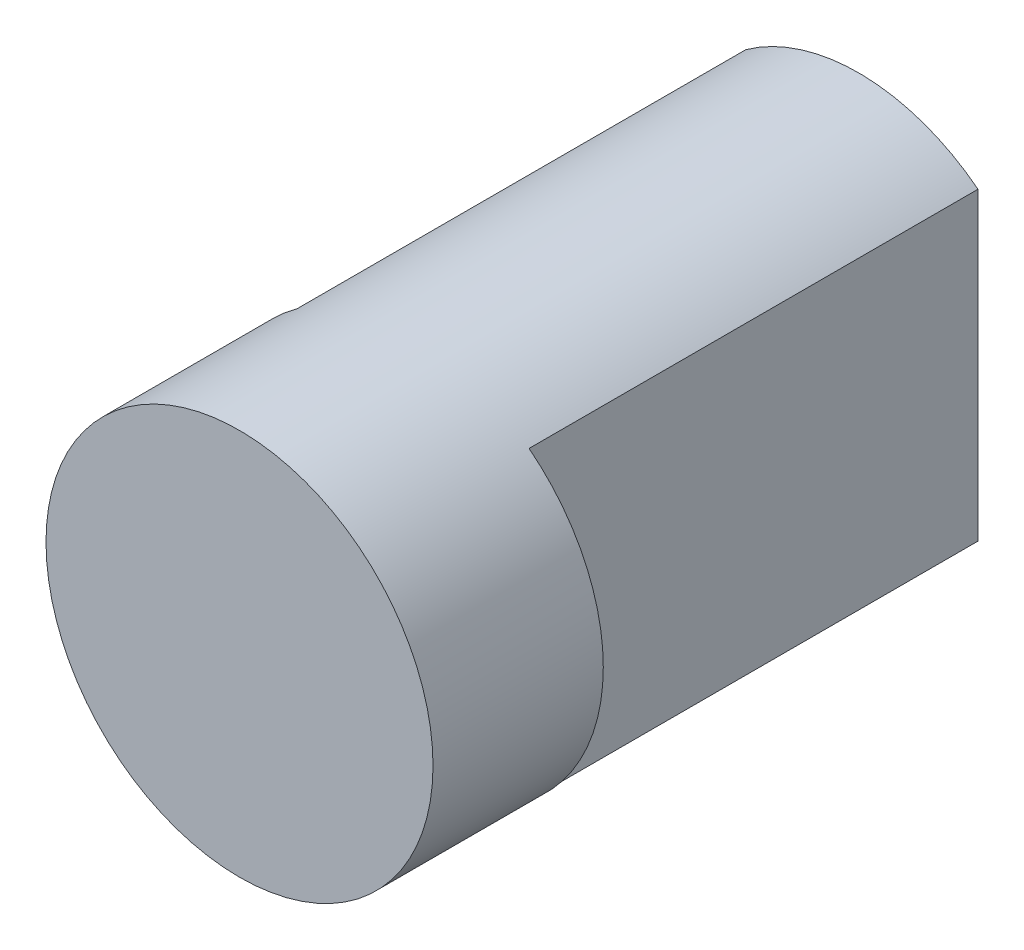
from build123d import *

# Parameters (mm, degrees)
SKETCH_2_R          = 2.5
EXTRUDE_1_DEPTH     = 8
CUT_EXTRUDE_START   = -5.8
CUT_EXTRUDE_1_DEPTH = 5.8


with BuildPart() as part:
    # 草图2 → 凸台-拉伸1 (new body)
    with BuildSketch(Plane(origin=(0, 0, 4.385209583), x_dir=(-1, 0, 0), z_dir=(0, 0, -1))):
        with Locations((-50.023496645, 46.50258845)):
            Circle(SKETCH_2_R)
    extrude(amount=EXTRUDE_1_DEPTH)

    # 草图3 → 切除-拉伸1 (cut)
    with BuildSketch(Plane(origin=(0, 0, -3.614790417), x_dir=(-1, 0, 0), z_dir=(0, 0, -1)).offset(CUT_EXTRUDE_START)):
        with BuildLine():
            Line((-51.564528211, 48.471146733), (-51.564528211, 44.534030167))
            ThreePointArc((-51.564528211, 44.534030167), (-52.523496645, 46.50258845), (-51.564528211, 48.471146733))
        make_face()
        with BuildLine():
            Line((-48.564528211, 48.532714335), (-48.564528211, 44.472462565))
            ThreePointArc((-48.564528211, 44.472462565), (-47.523496645, 46.50258845), (-48.564528211, 48.532714335))
        make_face()
    extrude(amount=CUT_EXTRUDE_1_DEPTH, mode=Mode.SUBTRACT)


solid = part.part
